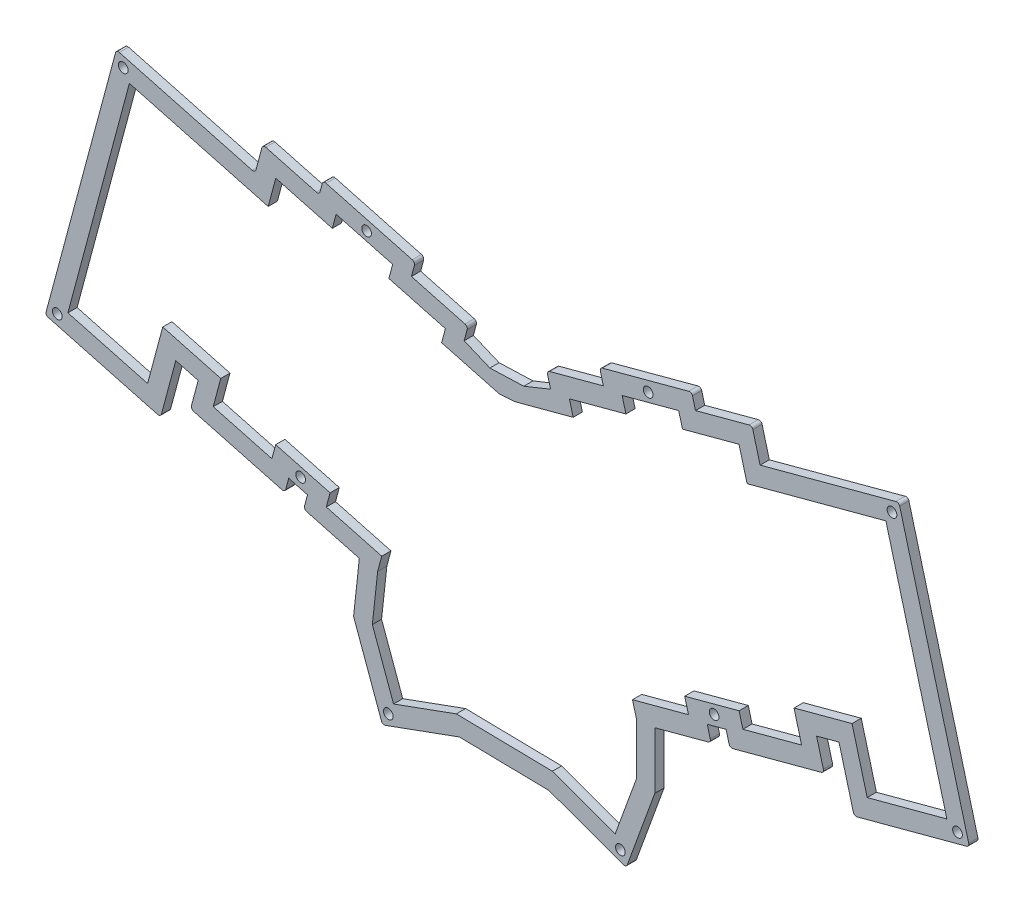
from build123d import *

# Parameters (mm, degrees)
MODEL_R             = 1.575
BOSS_EXTRUDE1_DEPTH = 3
FILLET1_R           = 1


with BuildPart() as part:
    # Model → Boss-Extrude1 (new body)
    with BuildSketch(Plane.XY):
        Polygon((142.344747242, 270.871489374), (153.37187249, 271.263447748), (162.091473536, 274.767362889), (160.85900272, 279.367807803), (179.260689602, 284.297666211), (178.028627015, 288.898354165), (208.019481767, 296.93522173), (209.252454514, 292.334187025), (227.65276755, 297.263677376), (230.276304619, 287.470798216), (275.446186014, 299.571346393), (298.39980436, 213.909597233), (260.87259576, 203.855963236), (255.943287021, 222.255598366), (248.650938057, 220.301667543), (251.115775513, 211.101166572), (220.422247557, 202.878292884), (219.189771603, 207.477473721), (213.081966369, 205.841177268), (214.314693354, 201.241059665), (196.039346948, 196.343682115), (196.007810089, 177.840578221), (186.702312667, 152.27893851), (161.565977706, 161.426447529), (132.435827139, 161.934428279), (107.399642776, 152.824765622), (97.980730454, 178.710864183), (99.858189105, 195.997881416), (81.758593313, 200.846808858), (82.991121062, 205.447466285), (76.882860045, 207.083884844), (75.650856625, 202.485184579), (44.956891994, 210.708175253), (47.421773629, 219.90863481), (40.129543563, 221.862285479), (35.199939127, 203.463086712), (-2.32684459, 213.517448416), (20.785545351, 299.774827661), (65.955825932, 287.671594898), (68.42160019, 296.872525865), (86.820985153, 291.940533454), (88.054439652, 296.542595671), (118.044472643, 288.503706576), (116.812112756, 283.905728394), (135.211333861, 278.973779905), (133.979081507, 274.376202933), align=None)
        with Locations((23.035554, 295.877718337)):
            Circle(MODEL_R, mode=Mode.SUBTRACT)
        with Locations((109.301822433, 156.902965293)):
            Circle(MODEL_R, mode=Mode.SUBTRACT)
        with Locations((184.800560745, 156.35733766)):
            Circle(MODEL_R, mode=Mode.SUBTRACT)
        with Locations((193.847437398, 289.84318413)):
            Circle(MODEL_R, mode=Mode.SUBTRACT)
        with Locations((102.225689846, 289.449650012)):
            Circle(MODEL_R, mode=Mode.SUBTRACT)
        with Locations((273.19609114, 295.674286852)):
            Circle(MODEL_R, mode=Mode.SUBTRACT)
        with Locations((1.570241786, 215.767496811)):
            Circle(MODEL_R, mode=Mode.SUBTRACT)
        with Locations((294.502731407, 216.159668876)):
            Circle(MODEL_R, mode=Mode.SUBTRACT)
        with Locations((80.760413887, 209.339268578)):
            Circle(MODEL_R, mode=Mode.SUBTRACT)
        with Locations((215.312231294, 209.732861073)):
            Circle(MODEL_R, mode=Mode.SUBTRACT)
        Polygon((271.203498451, 292.223209107), (291.05122826, 218.15247975), (265.115556398, 211.204247731), (260.186189629, 229.604099473), (241.30271159, 224.544411578), (243.767491017, 215.34412721), (224.664804007, 210.226469096), (223.432328054, 214.825649934), (205.733277658, 210.084029615), (206.966112962, 205.483507804), (188.744476932, 200.600523414), (190.038361872, 195.770837942), (190.009613349, 178.903688177), (183.116533861, 159.968814913), (162.674398087, 167.40803076), (131.428930231, 167.95289908), (110.986427135, 160.514692668), (104.096364698, 179.45072575), (105.814746135, 195.273012707), (107.149713912, 200.256048118), (89.106877808, 205.089769496), (90.339405557, 209.690426923), (72.639899407, 214.432169339), (71.407895987, 209.833469074), (52.305208977, 214.951127188), (54.770081908, 224.151554257), (35.886712889, 229.210569975), (30.957132238, 210.811459981), (5.0216469, 217.76022363), (25.028202346, 292.426367848), (70.198239559, 280.323200295), (72.663861356, 289.523562363), (91.063082461, 284.591613875), (92.29653696, 289.193676092), (110.695758065, 284.261727603), (109.463398178, 279.663749421), (127.862619282, 274.731800932), (126.630323598, 270.134062294), (145.381260936, 265.108396206), (150.690394167, 265.500431998), (169.439649748, 270.524806438), (168.207287216, 275.124847165), (186.60841776, 280.054556529), (185.376246939, 284.655648642), (203.777033628, 289.586641337), (205.009898064, 284.986010813), (223.409806911, 289.915392881), (226.033325469, 280.122582817), align=None, mode=Mode.SUBTRACT)
    extrude(amount=-BOSS_EXTRUDE1_DEPTH)

    # Fillet1
    fillet1_edges = [part.edges().sort_by_distance(p)[0] for p in [
        (-2.32684459, 213.517448416, -1.5),
        (20.785545351, 299.774827661, -1.5),
        (65.955825932, 287.671594898, -1.5),
        (68.42160019, 296.872525865, -1.5),
        (86.820985153, 291.940533454, -1.5),
        (88.054439652, 296.542595671, -1.5),
        (118.044472643, 288.503706576, -1.5),
        (135.211333861, 278.973779905, -1.5),
        (160.85900272, 279.367807803, -1.5),
        (178.028627015, 288.898354165, -1.5),
        (208.019481767, 296.93522173, -1.5),
        (227.65276755, 297.263677376, -1.5),
        (275.446186014, 299.571346393, -1.5),
        (298.39980436, 213.909597233, -1.5),
        (260.87259576, 203.855963236, -1.5),
        (251.115775513, 211.101166572, -1.5),
        (220.422247557, 202.878292884, -1.5),
        (214.314693354, 201.241059665, -1.5),
        (186.702312667, 152.27893851, -1.5),
        (107.399642776, 152.824765622, -1.5),
        (81.758593313, 200.846808858, -1.5),
        (75.650856625, 202.485184579, -1.5),
        (44.956891994, 210.708175253, -1.5),
        (35.199939127, 203.463086712, -1.5),
    ]]
    fillet(fillet1_edges, radius=FILLET1_R)


solid = part.part
